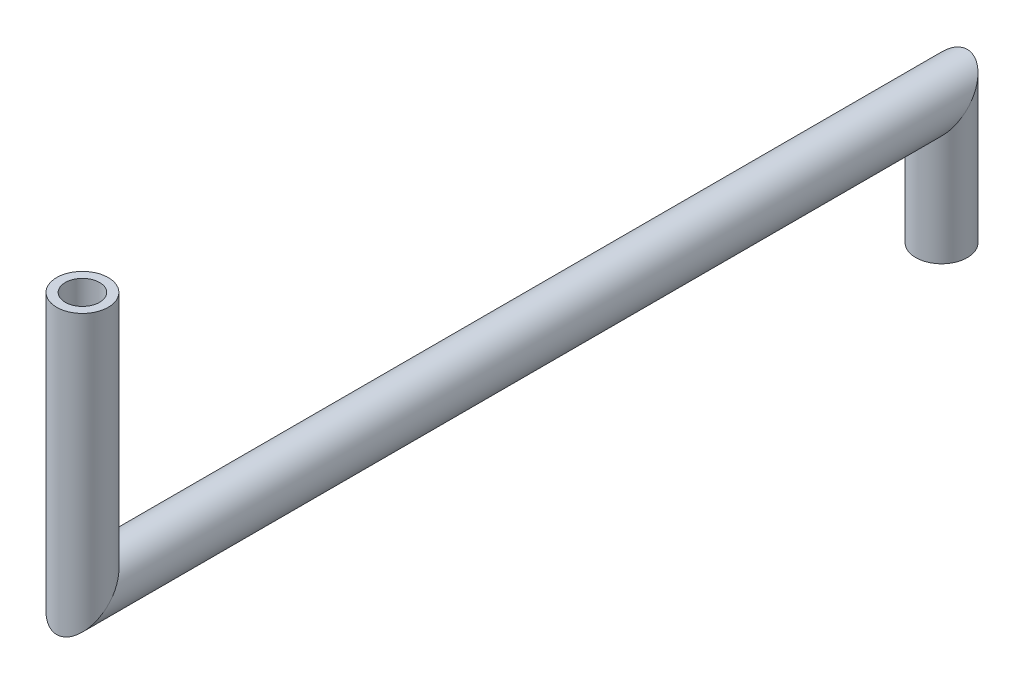
from build123d import *

# Parameters (mm, degrees)
SKETCH4_R   = 60
SKETCH4_R_2 = 40


with BuildPart() as part:
    # Sweep1: sweep along a path in Sketch1
    with BuildLine(Plane(origin=(0, 0, 0), x_dir=(0, 0, -1), z_dir=(1, 0, 0))) as sweep1_path:
        Line((0, 0), (0, 300))
        Line((0, 300), (-2000, 300))
        Line((-2000, 300), (-2000, 900))
    # Sketch4 → Sweep1 (sweep)
    with BuildSketch(Plane(origin=(0, 0, 0), x_dir=(1, 0, 0), z_dir=(0, 1, 0))):
        Circle(SKETCH4_R)
        Circle(SKETCH4_R_2, mode=Mode.SUBTRACT)
    sweep(path=sweep1_path.line, transition=Transition.RIGHT)


solid = part.part
